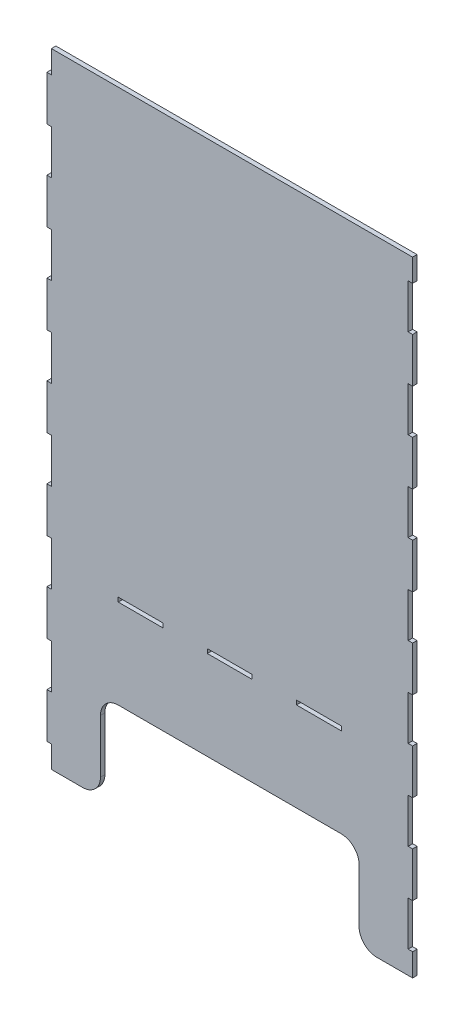
from build123d import *

# Parameters (mm, degrees)
AUFSATZ_LINEAR_AUSTRAGEN1_DEPTH = 5
SKIZZE2_W                       = 50.3
SKIZZE2_H                       = 4.8
SCHNITT_LINEAR_AUSTRAGEN1_DEPTH = 5
LINEARES_MUSTER1_COUNT          = 3
LINEARES_MUSTER1_PITCH          = 99.9
SKIZZE3_W                       = 92.912444059
SKIZZE3_H                       = 49.6
SCHNITT_LINEAR_AUSTRAGEN2_DEPTH = 5
LINEARES_MUSTER2_COUNT          = 8
LINEARES_MUSTER2_PITCH          = 99.9
SKIZZE4_W                       = 86.468004991
SKIZZE4_H                       = 49.6
SCHNITT_LINEAR_AUSTRAGEN4_DEPTH = 5
LINEARES_MUSTER3_COUNT          = 7
LINEARES_MUSTER3_PITCH          = 99.9


with BuildPart() as part:
    # Skizze1 → Aufsatz-Linear austragen1 (new body)
    with BuildSketch(Plane.XY):
        with BuildLine():
            Line((0, 0), (0, 700))
            Line((0, 700), (410, 700))
            Line((410, 700), (410, 0))
            Line((410, 0), (370, 0))
            ThreePointArc((370, 0), (355.857864376, 5.857864376), (350, 20))
            Line((350, 20), (350, 80))
            ThreePointArc((350, 80), (344.142135624, 94.142135624), (330, 100))
            Line((330, 100), (80, 100))
            ThreePointArc((80, 100), (65.857864376, 94.142135624), (60, 80))
            Line((60, 80), (60, 20))
            ThreePointArc((60, 20), (54.142135624, 5.857864376), (40, 0))
            Line((40, 0), (0, 0))
        make_face()
    extrude(amount=AUFSATZ_LINEAR_AUSTRAGEN1_DEPTH)

    # Skizze2 → Schnitt-Linear austragen1 (cut)
    with BuildSketch(Plane.XY.offset(5)):
        with Locations((105.1, 202.4)):
            Rectangle(SKIZZE2_W, SKIZZE2_H)
    schnitt_linear_austragen1 = extrude(amount=-SCHNITT_LINEAR_AUSTRAGEN1_DEPTH, mode=Mode.SUBTRACT)

    # Lineares Muster1: Schnitt-Linear austragen1 ×3
    with Locations(*[(i * LINEARES_MUSTER1_PITCH, 0, 0) for i in range(1, LINEARES_MUSTER1_COUNT)]):
        add(schnitt_linear_austragen1, mode=Mode.SUBTRACT)

    # Skizze3 → Schnitt-Linear austragen2 (cut)
    with BuildSketch(Plane.XY.offset(5)):
        with Locations((-41.45622203, 699.3)):
            Rectangle(SKIZZE3_W, SKIZZE3_H)
    schnitt_linear_austragen2 = extrude(amount=-SCHNITT_LINEAR_AUSTRAGEN2_DEPTH, mode=Mode.SUBTRACT)

    # Lineares Muster2: Schnitt-Linear austragen2 ×8
    with Locations(*[(0, -i * LINEARES_MUSTER2_PITCH, 0) for i in range(1, LINEARES_MUSTER2_COUNT)]):
        add(schnitt_linear_austragen2, mode=Mode.SUBTRACT)

    # Skizze4 → Schnitt-Linear austragen4 (cut)
    with BuildSketch(Plane.XY.offset(5)):
        with Locations((448.234002496, 649.7)):
            Rectangle(SKIZZE4_W, SKIZZE4_H)
    schnitt_linear_austragen4 = extrude(amount=-SCHNITT_LINEAR_AUSTRAGEN4_DEPTH, mode=Mode.SUBTRACT)

    # Lineares Muster3: Schnitt-Linear austragen4 ×7
    with Locations(*[(0, -i * LINEARES_MUSTER3_PITCH, 0) for i in range(1, LINEARES_MUSTER3_COUNT)]):
        add(schnitt_linear_austragen4, mode=Mode.SUBTRACT)


solid = part.part
